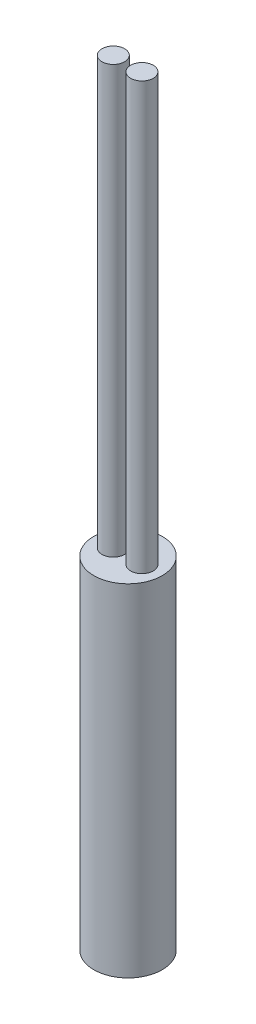
from build123d import *

# Parameters (mm, degrees)
SKETCH_1_R          = 10.5
EXTRUDE_1_DEPTH     = 80
SKETCH_2_R          = 2.649752209
EXTRUDE_2_DEPTH     = 100
SKETCH_3_R          = 10.5
SKETCH_3_R_2        = 8
CUT_EXTRUDE_1_DEPTH = 181.61146143


with BuildPart() as part:
    # 草图1 → 凸台-拉伸1 (new body)
    with BuildSketch(Plane(origin=(0, 0, 0), x_dir=(1, 0, 0), z_dir=(0, 1, 0))):
        with Locations(Location((0, 0, 0), (0, 0, 270))):
            Circle(SKETCH_1_R)
    extrude(amount=EXTRUDE_1_DEPTH)

    # 草图2 → 凸台-拉伸2 (add)
    with BuildSketch(Plane(origin=(0, 80, 0), x_dir=(1, 0, 0), z_dir=(0, 1, 0))):
        with Locations(Location((-3.354877279, -0.090103274, 0), (0, 0, 90))):
            Circle(SKETCH_2_R)
        with Locations(Location((3.354877279, -0.090103274, 0), (0, 0, 90))):
            Circle(SKETCH_2_R)
    extrude(amount=EXTRUDE_2_DEPTH)

    # 草图3 → 切除-拉伸1 (cut, through all)
    with BuildSketch(Plane.XZ):
        Circle(SKETCH_3_R)
        with Locations(Location((0, 0, 0), (0, 0, 270))):
            Circle(SKETCH_3_R_2, mode=Mode.SUBTRACT)
    extrude(amount=-CUT_EXTRUDE_1_DEPTH, mode=Mode.SUBTRACT)


solid = part.part
